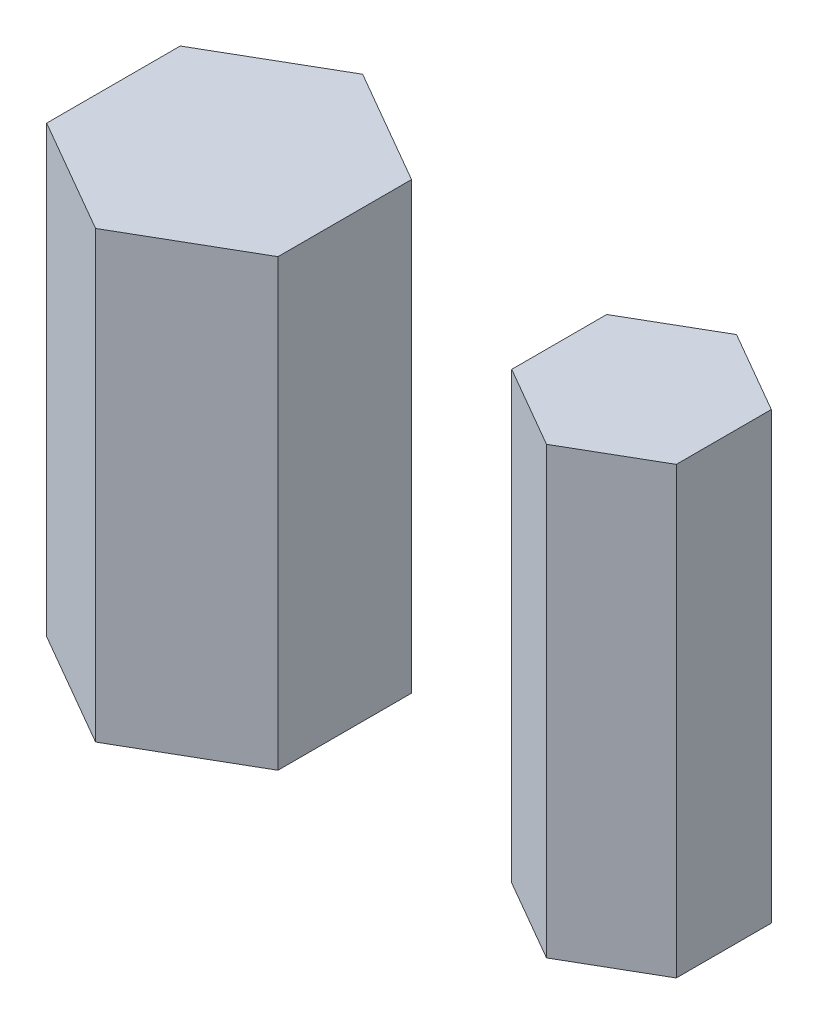
from build123d import *

# Parameters (mm, degrees)
BOSS_EXTRUDE1_DEPTH   = 10
BOSS_EXTRUDE1_2_DEPTH = 10


with BuildPart() as part:
    # Sketch1 → Boss-Extrude1 (new body)
    with BuildSketch(Plane(origin=(0, 0, 0), x_dir=(1, 0, 0), z_dir=(0, 1, 0))):
        Polygon((0, -3.0022214), (2.6, -1.5011107), (2.6, 1.5011107), (0, 3.0022214), (-2.6, 1.5011107), (-2.6, -1.5011107), align=None)
    extrude(amount=BOSS_EXTRUDE1_DEPTH)


with BuildPart() as body_2:
    # Sketch1 → Boss-Extrude1 2 (new body)
    with BuildSketch(Plane(origin=(0, 0, 0), x_dir=(1, 0, 0), z_dir=(0, 1, 0))):
        Polygon((9.271318191, -2.136195996), (11.121318191, -1.068097998), (11.121318191, 1.068097998), (9.271318191, 2.136195996), (7.421318191, 1.068097998), (7.421318191, -1.068097998), align=None)
    extrude(amount=BOSS_EXTRUDE1_2_DEPTH)


solid = Compound([part.part, body_2.part])
